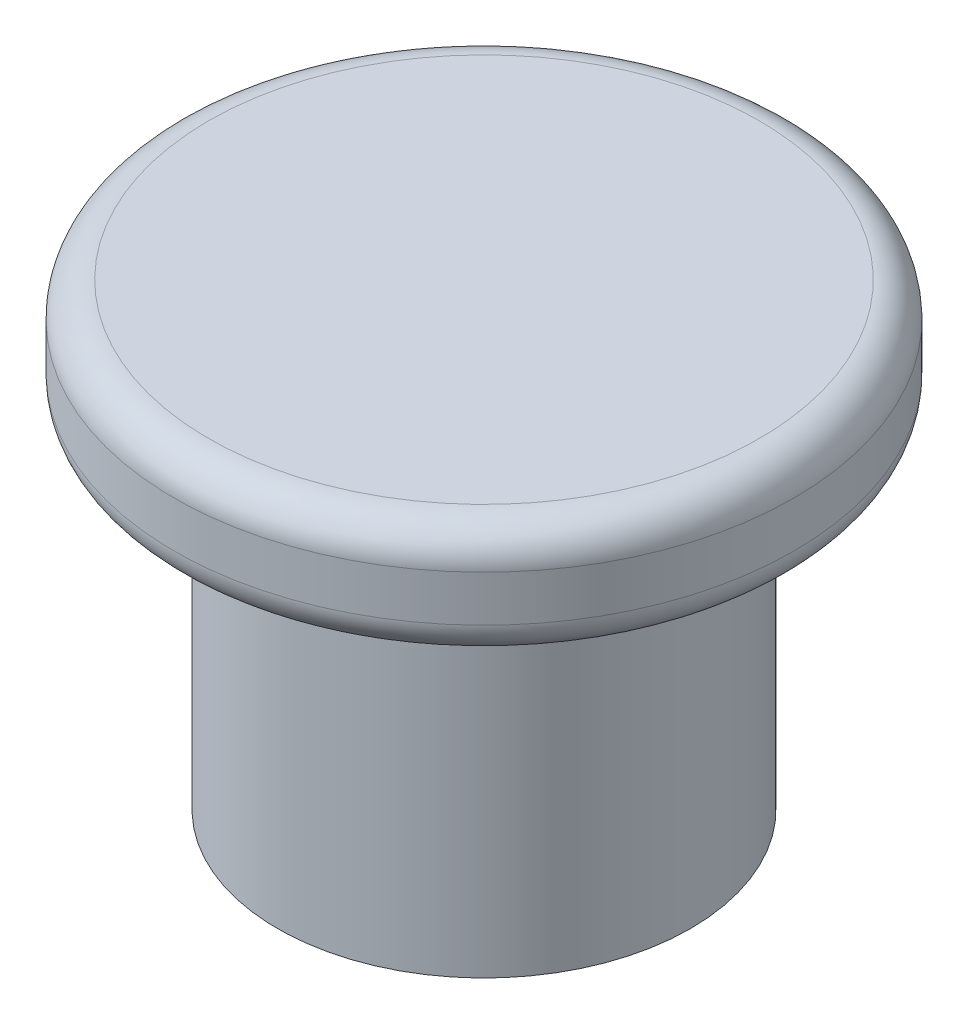
from build123d import *

# Parameters (mm, degrees)
SKETCH2_R          = 14
CUT_EXTRUDE1_DEPTH = 30


with BuildPart() as part:
    # Sketch1 → Revolve1 (revolve)
    with BuildSketch(Plane.XY, mode=Mode.PRIVATE) as revolve1_sk:
        with BuildLine():
            Line((0, -20), (18, -20))
            Line((18, -20), (18, 10))
            Line((18, 10), (24, 10))
            ThreePointArc((24, 10), (26.121320344, 10.878679656), (27, 13))
            Line((27, 13), (27, 17))
            ThreePointArc((27, 17), (26.121320344, 19.121320344), (24, 20))
            Line((24, 20), (0, 20))
            Line((0, 20), (0, -20))
        make_face()
    revolve(revolve1_sk.sketch.rotate(Axis((0, 20, 0), (0, -1, 0)), 180), axis=Axis((0, 20, 0), (0, -1, 0)))

    # Sketch2 → Cut-Extrude1 (cut)
    with BuildSketch(Plane.XZ.offset(20)):
        Circle(SKETCH2_R)
    extrude(amount=-CUT_EXTRUDE1_DEPTH, mode=Mode.SUBTRACT)


solid = part.part
